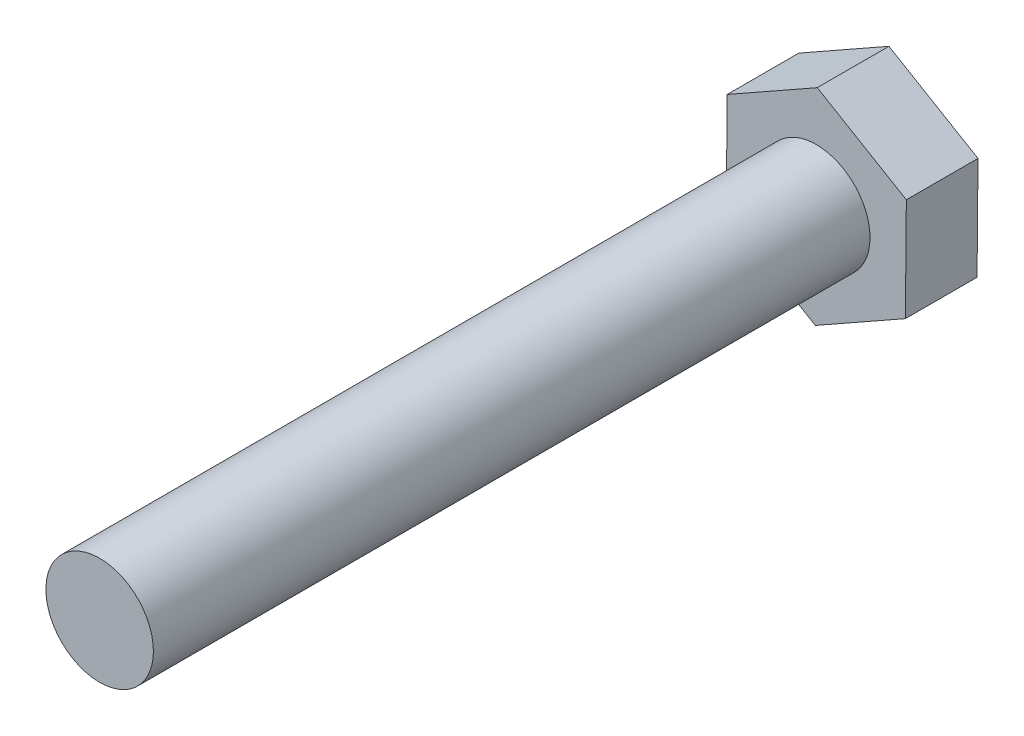
from build123d import *

# Parameters (mm, degrees)
EXTRUDE_1_DEPTH = 4
SKETCH_2_R      = 3
EXTRUDE_2_DEPTH = 40


with BuildPart() as part:
    # Эскиз1 → Бобышка-Вытянуть1 (new body)
    with BuildSketch(Plane.XY):
        Polygon((4.973514733, -2.932146745), (5.026070936, 2.841116732), (0.052556203, 5.773263477), (-4.973514733, 2.932146745), (-5.026070936, -2.841116732), (-0.052556203, -5.773263477), align=None)
    extrude(amount=EXTRUDE_1_DEPTH)

    # Эскиз2 → Бобышка-Вытянуть2 (add)
    with BuildSketch(Plane.XY.offset(4)):
        Circle(SKETCH_2_R)
    extrude(amount=EXTRUDE_2_DEPTH)


solid = part.part
